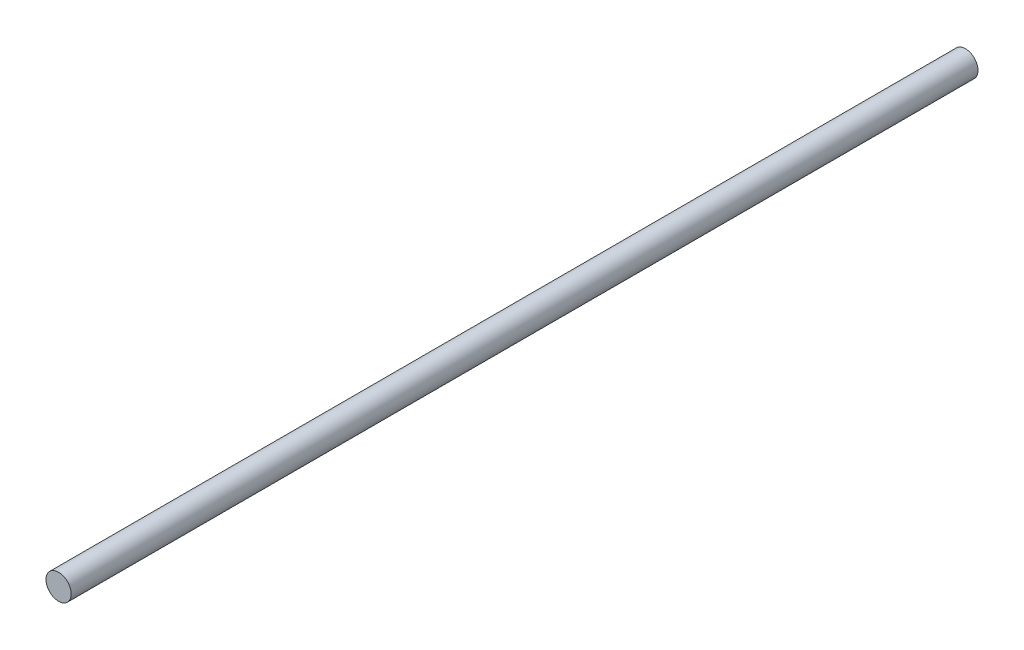
from build123d import *

# Parameters (mm, degrees)
SKETCH1_R           = 3.175
BOSS_EXTRUDE1_DEPTH = 228.6


with BuildPart() as part:
    # Sketch1 → Boss-Extrude1 (new body)
    with BuildSketch(Plane.XY):
        Circle(SKETCH1_R)
    extrude(amount=BOSS_EXTRUDE1_DEPTH)


solid = part.part
